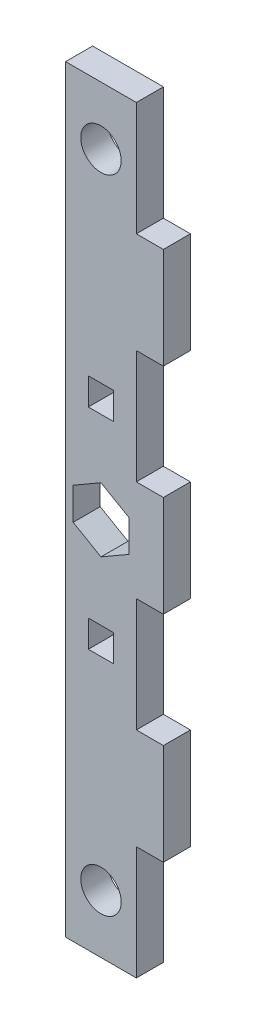
from build123d import *

# Parameters (mm, degrees)
MODEL_R             = 4
MODEL_W             = 5
MODEL_H             = 5.35
BOSS_EXTRUDE1_DEPTH = 5.35


with BuildPart() as part:
    # Model → Boss-Extrude1 (new body)
    with BuildSketch(Plane.XY):
        Polygon((0, 0), (14, 0), (14, 22.5), (19.35, 22.5), (19.35, 42.5), (14, 42.5), (14, 65), (19.35, 65), (19.35, 85), (14, 85), (14, 107.5), (19.35, 107.5), (19.35, 127.5), (14, 127.5), (14, 150), (0, 150), align=None)
        with Locations((7, 138.5)):
            Circle(MODEL_R, mode=Mode.SUBTRACT)
        with Locations(Location((7, 11.5, 0), (0, 0, 180))):
            Circle(MODEL_R, mode=Mode.SUBTRACT)
        with Locations((7, 95.75)):
            Rectangle(MODEL_W, MODEL_H, mode=Mode.SUBTRACT)
        Polygon((7, 81.350852961), (1.5, 78.175426481), (1.5, 71.824573519), (7, 68.649147039), (12.5, 71.824573519), (12.5, 78.175426481), align=None, mode=Mode.SUBTRACT)
        with Locations((7, 54.25)):
            Rectangle(MODEL_W, MODEL_H, mode=Mode.SUBTRACT)
    extrude(amount=BOSS_EXTRUDE1_DEPTH)


solid = part.part
